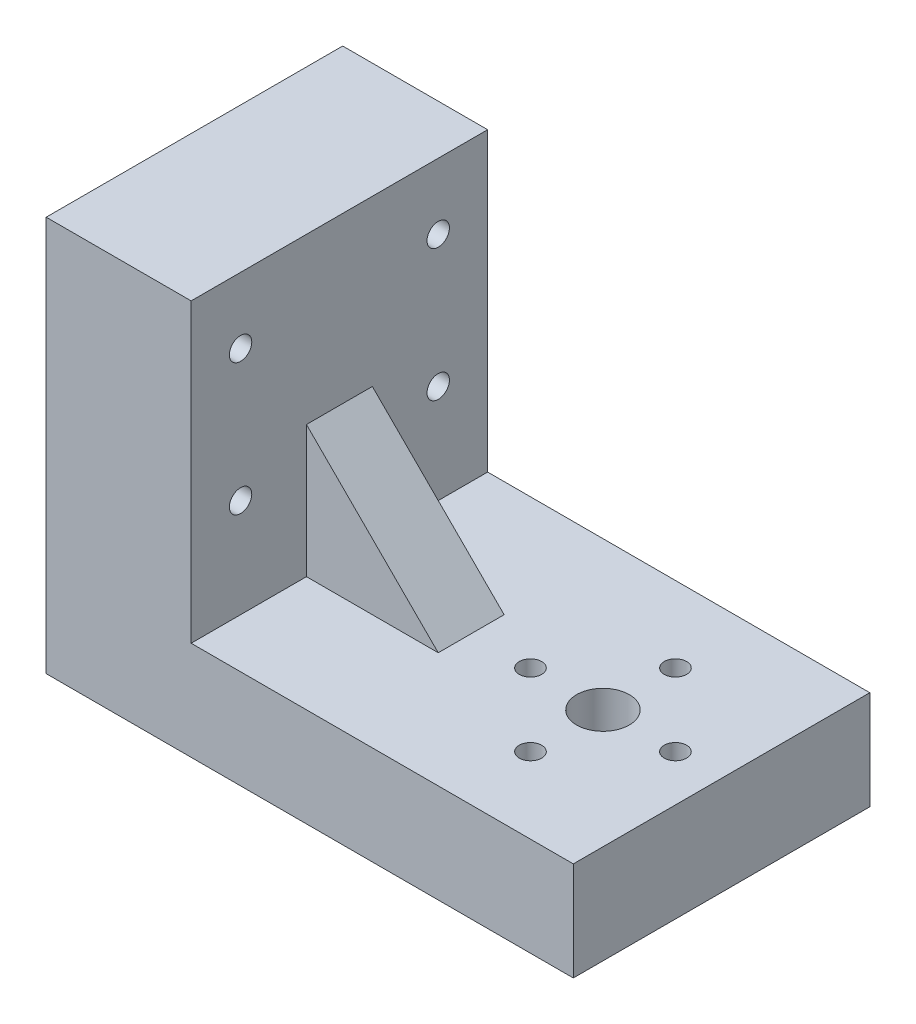
from build123d import *

# Parameters (mm, degrees)
BOSS_EXTRUDE3_DEPTH      = 22.5
BOSS_EXTRUDE3_DEPTH_BACK = 22.5
SKETCH1_W                = 22
SKETCH1_H                = 60
BOSS_EXTRUDE4_DEPTH      = 22.5
BOSS_EXTRUDE4_DEPTH_BACK = 22.5
SKETCH2_W                = 80
SKETCH2_H                = 15
CUT_EXTRUDE1_DEPTH       = 103.5
CUT_EXTRUDE1_DEPTH_BACK  = 103.5
SKETCH3_R                = 4
SKETCH3_R_2              = 1.7
CUT_EXTRUDE2_DEPTH       = 103.5
CUT_EXTRUDE2_DEPTH_BACK  = 103.5
SKETCH4_R                = 1.7
BOSS_EXTRUDE5_DEPTH      = 5
BOSS_EXTRUDE5_DEPTH_BACK = 5


with BuildPart() as part:
    # Sketch1 → Boss-Extrude3 (new, two sides: drawn at the far end of the back side and taken through both)
    with BuildSketch(Plane.XY.offset(-BOSS_EXTRUDE3_DEPTH_BACK)):
        with Locations((11, 30)):
            Rectangle(SKETCH1_W, SKETCH1_H)
    extrude(amount=BOSS_EXTRUDE3_DEPTH + BOSS_EXTRUDE3_DEPTH_BACK)

    # Sketch2 → Boss-Extrude4 (add, two sides: drawn at the far end of the back side and taken through both)
    with BuildSketch(Plane.XY.offset(-BOSS_EXTRUDE4_DEPTH_BACK)):
        with Locations((40, 7.5)):
            Rectangle(SKETCH2_W, SKETCH2_H)
    extrude(amount=BOSS_EXTRUDE4_DEPTH + BOSS_EXTRUDE4_DEPTH_BACK)

    # Sketch3 → Cut-Extrude1 (cut, two sides: drawn at the far end of the back side and taken through both)
    with BuildSketch(Plane(origin=(0, 0, 0), x_dir=(1, 0, 0), z_dir=(0, 1, 0)).offset(-CUT_EXTRUDE1_DEPTH_BACK)):
        with Locations((62, 0)):
            Circle(SKETCH3_R)
        with Locations((73, 0)):
            Circle(SKETCH3_R_2)
        with Locations((51, 0)):
            Circle(SKETCH3_R_2)
        with Locations((62, 11)):
            Circle(SKETCH3_R_2)
        with Locations((62, -11)):
            Circle(SKETCH3_R_2)
    extrude(amount=CUT_EXTRUDE1_DEPTH + CUT_EXTRUDE1_DEPTH_BACK, mode=Mode.SUBTRACT)

    # Sketch4 → Cut-Extrude2 (cut, two sides: drawn at the far end of the back side and taken through both)
    with BuildSketch(Plane(origin=(0, 0, 0), x_dir=(0, 0, -1), z_dir=(1, 0, 0)).offset(-CUT_EXTRUDE2_DEPTH_BACK)):
        with Locations((15, 30)):
            Circle(SKETCH4_R)
        with Locations((-15, 30)):
            Circle(SKETCH4_R)
        with Locations((15, 50)):
            Circle(SKETCH4_R)
        with Locations((-15, 50)):
            Circle(SKETCH4_R)
    extrude(amount=CUT_EXTRUDE2_DEPTH + CUT_EXTRUDE2_DEPTH_BACK, mode=Mode.SUBTRACT)

    # Sketch5 → Boss-Extrude5 (add, two sides: drawn at the far end of the back side and taken through both)
    with BuildSketch(Plane.XY.offset(-BOSS_EXTRUDE5_DEPTH_BACK)):
        Polygon((22, 15), (42, 15), (22, 35), align=None)
    extrude(amount=BOSS_EXTRUDE5_DEPTH + BOSS_EXTRUDE5_DEPTH_BACK)


solid = part.part
